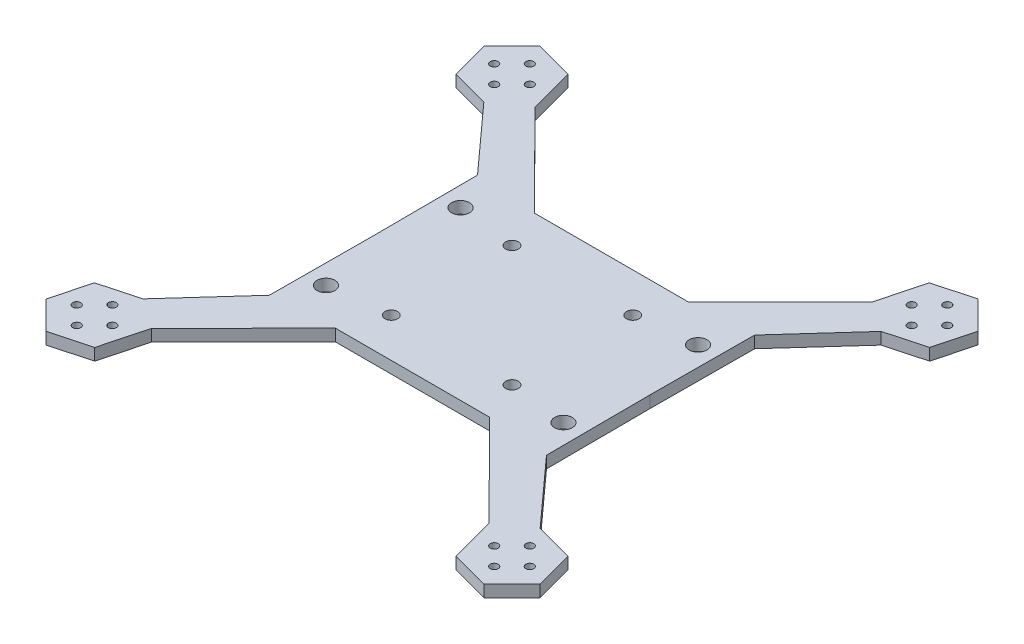
from build123d import *

# Parameters (mm, degrees)
SKETCH1_R           = 1
SKETCH1_R_2         = 2.25
SKETCH1_R_3         = 1.6
BOSS_EXTRUDE1_DEPTH = 3
SKETCH4_R           = 6.495043718
SKETCH4_R_2         = 4.9
BOSS_EXTRUDE3_DEPTH = 5
SKETCH6_W           = 8.48311055
SKETCH6_H           = 1.891574962
CUT_EXTRUDE3_DEPTH  = 34


with BuildPart() as part:
    # Sketch1 → Boss-Extrude1 (new body)
    with BuildSketch(Plane(origin=(0, 0, 0), x_dir=(1, 0, 0), z_dir=(0, 1, 0))):
        Polygon((43.076410298, 50.123925917), (42.618597625, 48.402115535), (19.4637773, 25.158118275), (-19.4637773, 25.158118275), (-42.618597625, 48.402115535), (-45.64603124, 59.788140743), (-55.300297258, 62.394891143), (-62.384942335, 55.337426715), (-59.815321393, 45.673211889), (-50.185022628, 43.072932893), (-35, 26.288270568), (-34.873, 0), (-35, -26.288270568), (-50.185022628, -43.072932893), (-59.815321393, -45.673211889), (-62.384942335, -55.337426715), (-55.300297258, -62.394891143), (-45.64603124, -59.788140743), (-42.618597625, -48.402115535), (-19.4637773, -25.158118275), (19.4637773, -25.158118275), (42.618597625, -48.402115535), (45.64603124, -59.788140743), (55.300297258, -62.394891143), (62.384942335, -55.337426715), (59.815321393, -45.673211889), (50.185022628, -43.072932893), (35, -26.288270568), (34.873, 0), (35, 26.288270568), (50.185022628, 43.072932893), (59.815321393, 45.673211889), (62.384942335, 55.337426715), (55.300297258, 62.394891143), (45.64603124, 59.788140743), align=None)
        with Locations(Location((-52.730676316, -57.230676316, 0), (0, 0, 270))):
            Circle(SKETCH1_R, mode=Mode.SUBTRACT)
        with Locations(Location((-57.230676316, -52.730676316, 0), (0, 0, 270))):
            Circle(SKETCH1_R, mode=Mode.SUBTRACT)
        with Locations(Location((-48.230676316, -52.730676316, 0), (0, 0, 270))):
            Circle(SKETCH1_R, mode=Mode.SUBTRACT)
        with Locations(Location((-52.730676316, -48.230676316, 0), (0, 0, 270))):
            Circle(SKETCH1_R, mode=Mode.SUBTRACT)
        with Locations(Location((-30, -17, 0), (0, 0, 270))):
            Circle(SKETCH1_R_2, mode=Mode.SUBTRACT)
        with Locations(Location((-15.25, -15.25, 0), (0, 0, 270))):
            Circle(SKETCH1_R_3, mode=Mode.SUBTRACT)
        with Locations(Location((52.730676316, -57.230676316, 0), (0, 0, 270))):
            Circle(SKETCH1_R, mode=Mode.SUBTRACT)
        with Locations(Location((48.230676316, -52.730676316, 0), (0, 0, 270))):
            Circle(SKETCH1_R, mode=Mode.SUBTRACT)
        with Locations(Location((52.730676316, -48.230676316, 0), (0, 0, 270))):
            Circle(SKETCH1_R, mode=Mode.SUBTRACT)
        with Locations(Location((57.230676316, -52.730676316, 0), (0, 0, 270))):
            Circle(SKETCH1_R, mode=Mode.SUBTRACT)
        with Locations(Location((30, -17, 0), (0, 0, 270))):
            Circle(SKETCH1_R_2, mode=Mode.SUBTRACT)
        with Locations(Location((15.25, -15.25, 0), (0, 0, 270))):
            Circle(SKETCH1_R_3, mode=Mode.SUBTRACT)
        with Locations(Location((-15.25, 15.25, 0), (0, 0, 270))):
            Circle(SKETCH1_R_3, mode=Mode.SUBTRACT)
        with Locations(Location((-30, 17, 0), (0, 0, 270))):
            Circle(SKETCH1_R_2, mode=Mode.SUBTRACT)
        with Locations(Location((-57.230676316, 52.730676316, 0), (0, 0, 270))):
            Circle(SKETCH1_R, mode=Mode.SUBTRACT)
        with Locations(Location((-52.730676316, 48.230676316, 0), (0, 0, 270))):
            Circle(SKETCH1_R, mode=Mode.SUBTRACT)
        with Locations(Location((-48.230676316, 52.730676316, 0), (0, 0, 270))):
            Circle(SKETCH1_R, mode=Mode.SUBTRACT)
        with Locations(Location((-52.730676316, 57.230676316, 0), (0, 0, 270))):
            Circle(SKETCH1_R, mode=Mode.SUBTRACT)
        with Locations(Location((15.25, 15.25, 0), (0, 0, 270))):
            Circle(SKETCH1_R_3, mode=Mode.SUBTRACT)
        with Locations(Location((30, 17, 0), (0, 0, 270))):
            Circle(SKETCH1_R_2, mode=Mode.SUBTRACT)
        with Locations(Location((52.730676316, 48.230676316, 0), (0, 0, 270))):
            Circle(SKETCH1_R, mode=Mode.SUBTRACT)
        with Locations(Location((48.230676316, 52.730676316, 0), (0, 0, 270))):
            Circle(SKETCH1_R, mode=Mode.SUBTRACT)
        with Locations(Location((57.230676316, 52.730676316, 0), (0, 0, 270))):
            Circle(SKETCH1_R, mode=Mode.SUBTRACT)
        with Locations(Location((52.730676316, 57.230676316, 0), (0, 0, 270))):
            Circle(SKETCH1_R, mode=Mode.SUBTRACT)
    extrude(amount=BOSS_EXTRUDE1_DEPTH)

    # Sketch4 → Boss-Extrude3 (add)
    with BuildSketch(Plane.XZ):
        with Locations(Location((0, 0, 0), (0, 0, 90))):
            Circle(SKETCH4_R)
        with Locations(Location((0, 0, 0), (0, 0, 270))):
            Circle(SKETCH4_R_2, mode=Mode.SUBTRACT)
    extrude(amount=BOSS_EXTRUDE3_DEPTH)

    # Sketch6 → Cut-Extrude3 (cut)
    with BuildSketch(Plane.XY.offset(35)):
        with Locations((0, -0.945787481)):
            Rectangle(SKETCH6_W, SKETCH6_H)
    extrude(amount=-CUT_EXTRUDE3_DEPTH, mode=Mode.SUBTRACT)


solid = part.part
